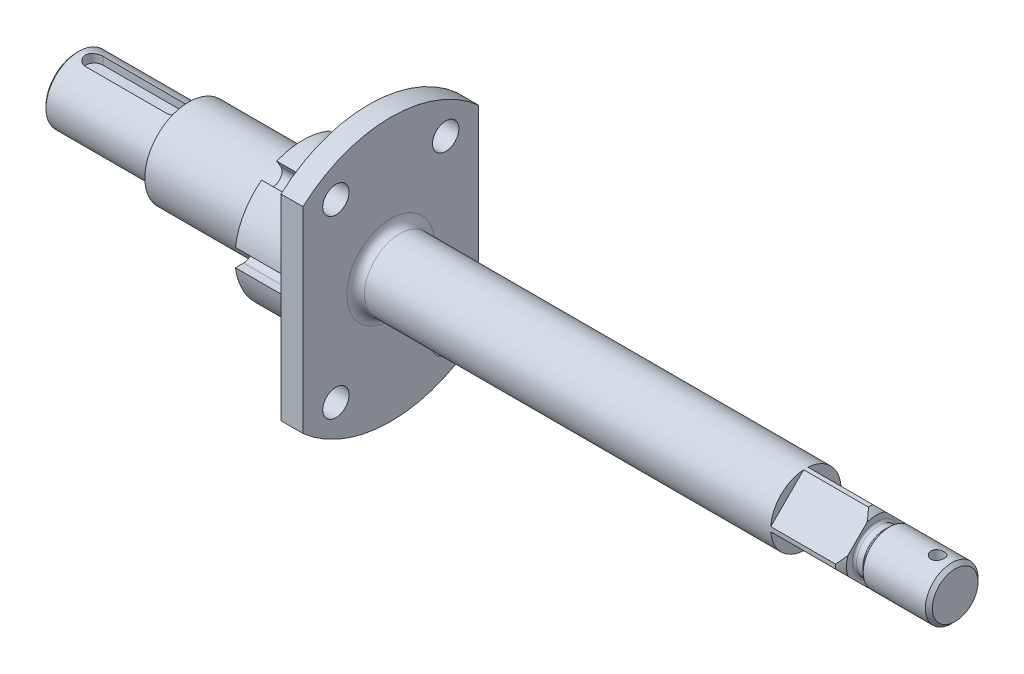
from build123d import *

# Parameters (mm, degrees)
SKETCH_2_OUTSIDE_W       = 208.902
SKETCH_2_OUTSIDE_H       = 208.902
CUT_EXTRUDE_1_DEPTH      = 68
CUT_EXTRUDE_2_DEPTH      = 4
CUT_EXTRUDE_4_DEPTH      = 409.900966005
CUT_EXTRUDE_4_DEPTH_BACK = 409.900966005
SKETCH_6_R               = 3
SKETCH_7_R               = 6
CUT_EXTRUDE_5_DEPTH      = 271.645524626
SKETCH_8_OUTSIDE_W       = 208.902
SKETCH_8_OUTSIDE_H       = 208.902
SKETCH_8_OUTSIDE_W_2     = 80
SKETCH_8_OUTSIDE_H_2     = 120
CUT_EXTRUDE_6_DEPTH      = 271.645524626
CUT_EXTRUDE_3_DEPTH      = 25
PATTERN_CIRCULAR_1_COUNT = 6


with BuildPart() as part:
    # Эскиз1 → Повернуть1 (revolve)
    with BuildSketch(Plane.XY, mode=Mode.PRIVATE) as revolve_1_sk:
        with BuildLine():
            Line((129, 31), (103, 31))
            Line((103, 31), (103, 20))
            Line((103, 20), (51, 20))
            Line((51, 20), (51, 15))
            Line((51, 15), (1, 15))
            Line((1, 15), (0, 14))
            Line((0, 14), (0, 0))
            Line((0, 0), (400, 0))
            Line((400, 0), (400, 10.4))
            Line((400, 10.4), (398.4, 12))
            Line((398.4, 12), (370.1, 12))
            Line((370.1, 12), (368.146446609, 10.046446609))
            ThreePointArc((368.146446609, 10.046446609), (367.984234935, 9.938060234), (367.792893219, 9.9))
            Line((367.792893219, 9.9), (365, 9.9))
            ThreePointArc((365, 9.9), (364.292893219, 10.192893219), (364, 10.9))
            Line((364, 10.9), (364, 13.5))
            Line((364, 13.5), (361.5, 16))
            Line((361.5, 16), (147, 16))
            ThreePointArc((147, 16), (144.171572875, 17.171572875), (143, 20))
            Line((143, 20), (143, 60))
            Line((143, 60), (133, 60))
            Line((133, 60), (133, 35))
            ThreePointArc((133, 35), (131.828427125, 32.171572875), (129, 31))
        make_face()
    revolve(revolve_1_sk.sketch.rotate(Axis((0, 0, 0), (1, 0, 0)), 90), axis=Axis((0, 0, 0), (1, 0, 0)))

    # Эскиз2 outside → Вырез-Вытянуть1 (cut)
    with BuildSketch(Plane(origin=(400, 0, 0), x_dir=(0, 0, -1), z_dir=(1, 0, 0))):
        Rectangle(SKETCH_2_OUTSIDE_W, SKETCH_2_OUTSIDE_H)
        Polygon((0, -16.970562748), (16.970562748, 0), (0, 16.970562748), (-16.970562748, 0), align=None, mode=Mode.SUBTRACT)
    extrude(amount=-CUT_EXTRUDE_1_DEPTH, mode=Mode.SUBTRACT)

    # Эскиз3 → Вырез-Вытянуть2 (cut)
    with BuildSketch(Plane(origin=(0, 15, 0), x_dir=(1, 0, 0), z_dir=(0, 1, 0))):
        with BuildLine():
            Line((8, 4), (45, 4))
            ThreePointArc((45, 4), (49, 0), (45, -4))
            Line((45, -4), (8, -4))
            ThreePointArc((8, -4), (4, 0), (8, 4))
        make_face()
    extrude(amount=-CUT_EXTRUDE_2_DEPTH, mode=Mode.SUBTRACT)

    # Эскиз6 → Вырез-Вытянуть4 (cut, two sides: drawn at the far end of the back side and taken through both)
    with BuildSketch(Plane(origin=(0, 0, 0), x_dir=(1, 0, 0), z_dir=(0, 1, 0)).offset(-CUT_EXTRUDE_4_DEPTH_BACK)):
        with Locations(Location((392, 0, 0), (0, 0, 270))):
            Circle(SKETCH_6_R)
    extrude(amount=CUT_EXTRUDE_4_DEPTH + CUT_EXTRUDE_4_DEPTH_BACK, mode=Mode.SUBTRACT)

    # Эскиз7 → Вырез-Вытянуть5 (cut, through all)
    with BuildSketch(Plane(origin=(143, 0, 0), x_dir=(0, 0, -1), z_dir=(1, 0, 0))):
        with Locations((-25, 40)):
            Circle(SKETCH_7_R)
        with Locations((-25, -40)):
            Circle(SKETCH_7_R)
        with Locations((25, -40)):
            Circle(SKETCH_7_R)
        with Locations((25, 40)):
            Circle(SKETCH_7_R)
    extrude(amount=-CUT_EXTRUDE_5_DEPTH, mode=Mode.SUBTRACT)

    # Эскиз8 outside → Вырез-Вытянуть6 (cut, through all)
    with BuildSketch(Plane(origin=(143, 0, 0), x_dir=(0, 0, -1), z_dir=(1, 0, 0))):
        Rectangle(SKETCH_8_OUTSIDE_W, SKETCH_8_OUTSIDE_H)
        Rectangle(SKETCH_8_OUTSIDE_W_2, SKETCH_8_OUTSIDE_H_2, mode=Mode.SUBTRACT)
    extrude(amount=-CUT_EXTRUDE_6_DEPTH, mode=Mode.SUBTRACT)

    # Эскиз4 → Вырез-Вытянуть3 (cut)
    with BuildSketch(Plane.ZY.offset(-103)):
        with BuildLine():
            Line((30.740852298, 4), (27, 4))
            ThreePointArc((27, 4), (23, 0), (27, -4))
            Line((27, -4), (30.740852298, -4))
            ThreePointArc((30.740852298, -4), (31, 0), (30.740852298, 4))
        make_face()
    cut_extrude_3 = extrude(amount=-CUT_EXTRUDE_3_DEPTH, mode=Mode.SUBTRACT)

    # Круговой массив1: Вырез-Вытянуть3 ×6 about axis
    pattern_circular_1_axis = Axis((0, 0, 0), (1, 0, 0))
    for i in range(1, PATTERN_CIRCULAR_1_COUNT):
        add(cut_extrude_3.rotate(pattern_circular_1_axis, i * 360 / PATTERN_CIRCULAR_1_COUNT), mode=Mode.SUBTRACT)


solid = part.part
